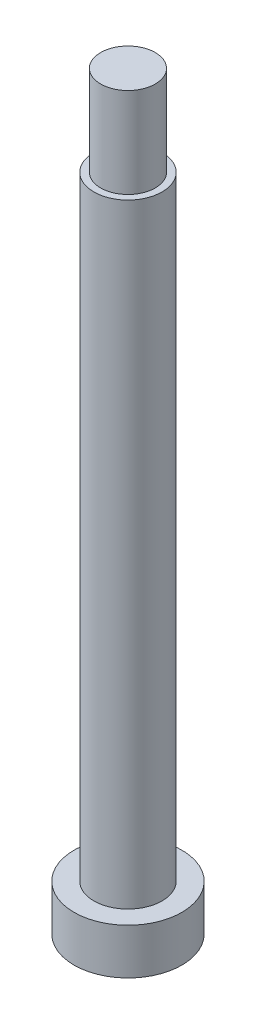
from build123d import *

# Parameters (mm, degrees)
SKETCH_1_R          = 4
EXTRUDE_1_DEPTH     = 109.9
SKETCH_1_3_R        = 5
SKETCH_1_3_R_2      = 4
EXTRUDE_2_DEPTH     = 96.7
SKETCH_1_4_R        = 7.9
SKETCH_1_4_R_2      = 5
EXTRUDE_3_DEPTH     = 6.7
CUT_EXTRUDE_1_DEPTH = 3


with BuildPart() as part:
    # 草图1 → 凸台-拉伸1 (new body)
    with BuildSketch(Plane(origin=(0, 0, 0), x_dir=(1, 0, 0), z_dir=(0, 1, 0))):
        Circle(SKETCH_1_R)
    extrude(amount=EXTRUDE_1_DEPTH)

    # 草图1<3> → 凸台-拉伸2 (add)
    with BuildSketch(Plane(origin=(0, 0, 0), x_dir=(1, 0, 0), z_dir=(0, 1, 0))):
        Circle(SKETCH_1_3_R)
        Circle(SKETCH_1_3_R_2, mode=Mode.SUBTRACT)
    extrude(amount=EXTRUDE_2_DEPTH)

    # 草图1<4> → 凸台-拉伸3 (add)
    with BuildSketch(Plane(origin=(0, 0, 0), x_dir=(1, 0, 0), z_dir=(0, 1, 0))):
        Circle(SKETCH_1_4_R)
        Circle(SKETCH_1_4_R_2, mode=Mode.SUBTRACT)
    extrude(amount=EXTRUDE_3_DEPTH)

    # 草图2 → 切除-拉伸1 (cut)
    with BuildSketch(Plane.XZ):
        Polygon((2.5, 1.443375673), (0, 2.886751346), (-2.5, 1.443375673), (-2.5, -1.443375673), (0, -2.886751346), (2.5, -1.443375673), align=None)
    extrude(amount=-CUT_EXTRUDE_1_DEPTH, mode=Mode.SUBTRACT)


solid = part.part
